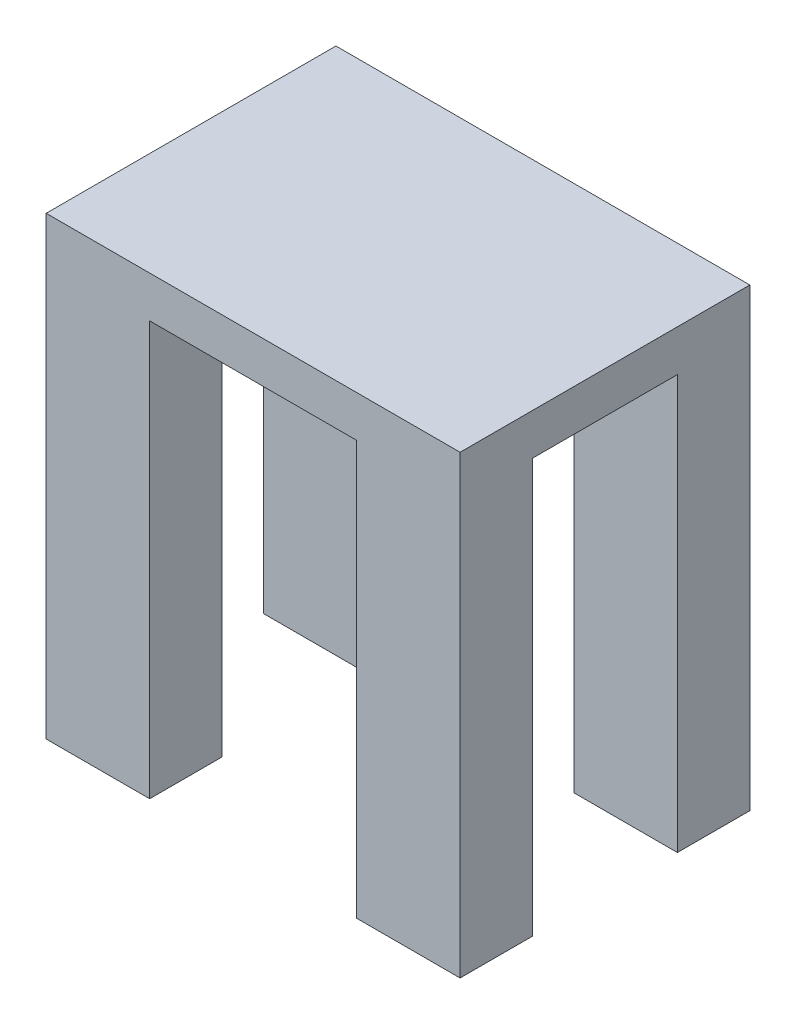
from build123d import *

# Parameters (mm, degrees)
CROQUIS2_W              = 500
CROQUIS2_H              = 350
SALIENTE_EXTRUIR1_DEPTH = 50
CROQUIS3_W              = 125
CROQUIS3_H              = 87.5
SALIENTE_EXTRUIR2_DEPTH = 500


with BuildPart() as part:
    # Croquis2 → Saliente-Extruir1 (new body)
    with BuildSketch(Plane(origin=(0, 0, 0), x_dir=(1, 0, 0), z_dir=(0, 1, 0))):
        Rectangle(CROQUIS2_W, CROQUIS2_H)
    extrude(amount=SALIENTE_EXTRUIR1_DEPTH)

    # Croquis3 → Saliente-Extruir2 (add)
    with BuildSketch(Plane.XZ):
        with Locations((-187.5, 131.25)):
            Rectangle(CROQUIS3_W, CROQUIS3_H)
        with Locations((-187.5, -131.25)):
            Rectangle(CROQUIS3_W, CROQUIS3_H)
        with Locations((187.5, -131.25)):
            Rectangle(CROQUIS3_W, CROQUIS3_H)
        with Locations((187.5, 131.25)):
            Rectangle(CROQUIS3_W, CROQUIS3_H)
    extrude(amount=SALIENTE_EXTRUIR2_DEPTH)


solid = part.part
